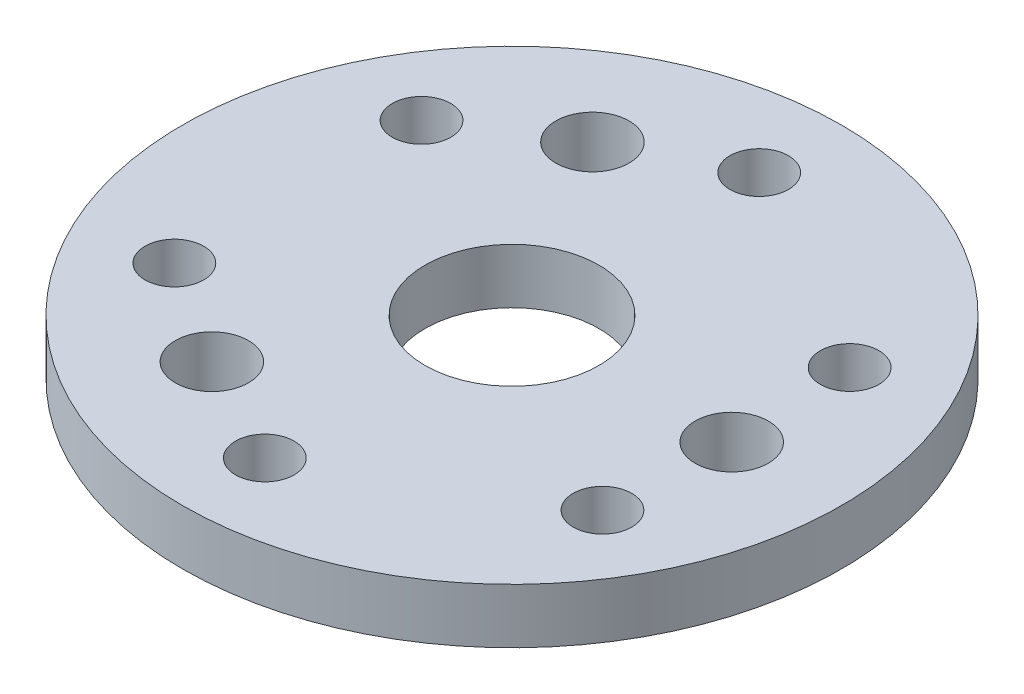
from build123d import *

# Parameters (mm, degrees)
SKETCH_1_R          = 18
SKETCH_1_R_2        = 1.6
SKETCH_1_R_3        = 2
EXTRUDE_1_DEPTH     = 3
SKETCH_3_R          = 4.75
CUT_EXTRUDE_1_DEPTH = 4


with BuildPart() as part:
    # 草图1 → 凸台-拉伸1 (new body)
    with BuildSketch(Plane(origin=(0, 0, 0), x_dir=(1, 0, 0), z_dir=(0, 1, 0))):
        with Locations(Location((0, 0, 0), (0, 0, 270))):
            Circle(SKETCH_1_R)
        with Locations(Location((0, 13.5, 0), (0, 0, 270))):
            Circle(SKETCH_1_R_2, mode=Mode.SUBTRACT)
        with Locations(Location((11.691342951, 6.75, 0), (0, 0, 270))):
            Circle(SKETCH_1_R_2, mode=Mode.SUBTRACT)
        with Locations(Location((11.691342951, -6.75, 0), (0, 0, 270))):
            Circle(SKETCH_1_R_2, mode=Mode.SUBTRACT)
        with Locations(Location((0, -13.5, 0), (0, 0, 270))):
            Circle(SKETCH_1_R_2, mode=Mode.SUBTRACT)
        with Locations(Location((-11.691342951, -6.75, 0), (0, 0, 270))):
            Circle(SKETCH_1_R_2, mode=Mode.SUBTRACT)
        with Locations(Location((-11.691342951, 6.75, 0), (0, 0, 270))):
            Circle(SKETCH_1_R_2, mode=Mode.SUBTRACT)
        with Locations(Location((12, 0, 0), (0, 0, 270))):
            Circle(SKETCH_1_R_3, mode=Mode.SUBTRACT)
        with Locations(Location((-6, -10.392304845, 0), (0, 0, 270))):
            Circle(SKETCH_1_R_3, mode=Mode.SUBTRACT)
        with Locations(Location((-6, 10.392304845, 0), (0, 0, 270))):
            Circle(SKETCH_1_R_3, mode=Mode.SUBTRACT)
    extrude(amount=EXTRUDE_1_DEPTH)

    # 草图3 → 切除-拉伸1 (cut)
    with BuildSketch(Plane(origin=(0, 3, 0), x_dir=(1, 0, 0), z_dir=(0, 1, 0))):
        with Locations(Location((0, 0, 0), (0, 0, 270))):
            Circle(SKETCH_3_R)
    extrude(amount=-CUT_EXTRUDE_1_DEPTH, mode=Mode.SUBTRACT)


solid = part.part
